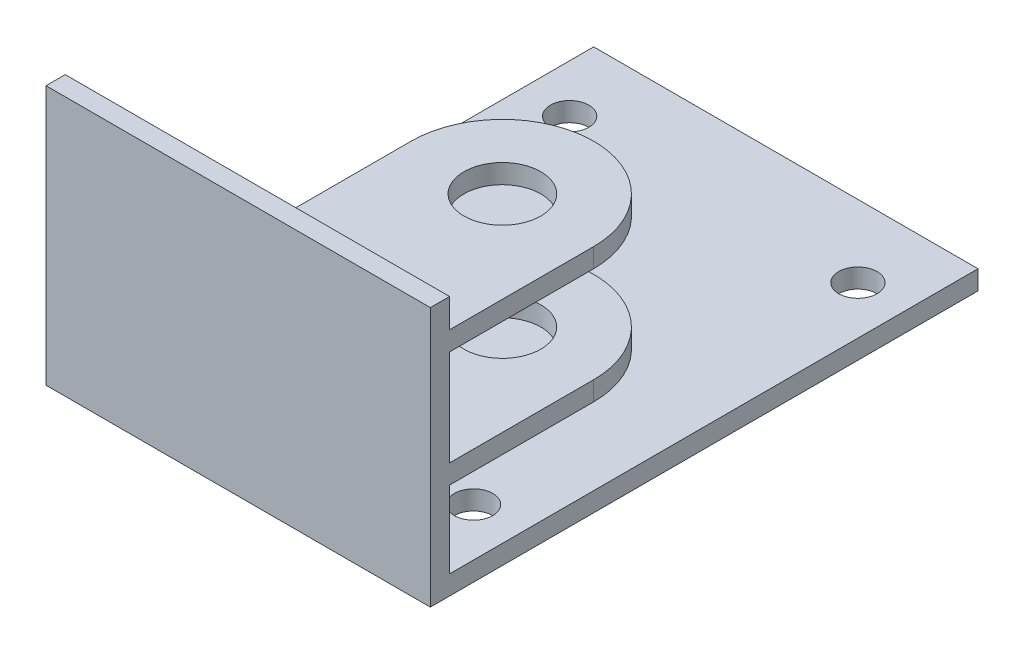
from build123d import *

# Parameters (mm, degrees)
CROQUIS2_W              = 40
CROQUIS2_H              = 55
CROQUIS2_R              = 2
SALIENTE_EXTRUIR1_DEPTH = 2
CROQUIS3_W              = 40
CROQUIS3_H              = 2
SALIENTE_EXTRUIR2_DEPTH = 42
CROQUIS4_R              = 4
SALIENTE_EXTRUIR3_DEPTH = 2
MATRIZL1_COUNT          = 2
MATRIZL1_PITCH          = 12
CROQUIS6_W              = 40
CROQUIS6_H              = 15
CORTAR_EXTRUIR1_DEPTH   = 10


with BuildPart() as part:
    # Croquis2 → Saliente-Extruir1 (new body)
    with BuildSketch(Plane(origin=(0, 0, 0), x_dir=(1, 0, 0), z_dir=(0, 1, 0))):
        with Locations((20, 27.5)):
            Rectangle(CROQUIS2_W, CROQUIS2_H)
        with Locations(Location((5, 47.5, 0), (0, 0, 270))):
            Circle(CROQUIS2_R, mode=Mode.SUBTRACT)
        with Locations(Location((35, 47.5, 0), (0, 0, 270))):
            Circle(CROQUIS2_R, mode=Mode.SUBTRACT)
        with Locations(Location((35, 7.5, 0), (0, 0, 270))):
            Circle(CROQUIS2_R, mode=Mode.SUBTRACT)
        with Locations(Location((5, 7.5, 0), (0, 0, 270))):
            Circle(CROQUIS2_R, mode=Mode.SUBTRACT)
    extrude(amount=SALIENTE_EXTRUIR1_DEPTH)

    # Croquis3 → Saliente-Extruir2 (add)
    with BuildSketch(Plane(origin=(0, 0, 0), x_dir=(1, 0, 0), z_dir=(0, 1, 0))):
        with Locations((20, -1)):
            Rectangle(CROQUIS3_W, CROQUIS3_H)
    extrude(amount=SALIENTE_EXTRUIR2_DEPTH)

    # Croquis4 → Saliente-Extruir3 (add)
    with BuildSketch(Plane(origin=(0, 22, 0), x_dir=(1, 0, 0), z_dir=(0, 1, 0))):
        with BuildLine():
            Line((40, 15), (40, 0))
            Line((40, 0), (21, 0))
            Line((21, 0), (21, 15))
            ThreePointArc((21, 15), (30.5, 24.5), (40, 15))
        make_face()
        with Locations(Location((30.5, 15, 0), (0, 0, 270))):
            Circle(CROQUIS4_R, mode=Mode.SUBTRACT)
    saliente_extruir3 = extrude(amount=SALIENTE_EXTRUIR3_DEPTH)

    # MatrizL1: Saliente-Extruir3 ×2
    with Locations(*[(0, -i * MATRIZL1_PITCH, 0) for i in range(1, MATRIZL1_COUNT)]):
        add(saliente_extruir3)

    # Croquis6 → Cortar-Extruir1 (cut)
    with BuildSketch(Plane(origin=(0, 0, 0), x_dir=(-1, 0, 0), z_dir=(0, 0, -1))):
        with Locations((-20, 34.5)):
            Rectangle(CROQUIS6_W, CROQUIS6_H)
    extrude(amount=-CORTAR_EXTRUIR1_DEPTH, mode=Mode.SUBTRACT)


solid = part.part
